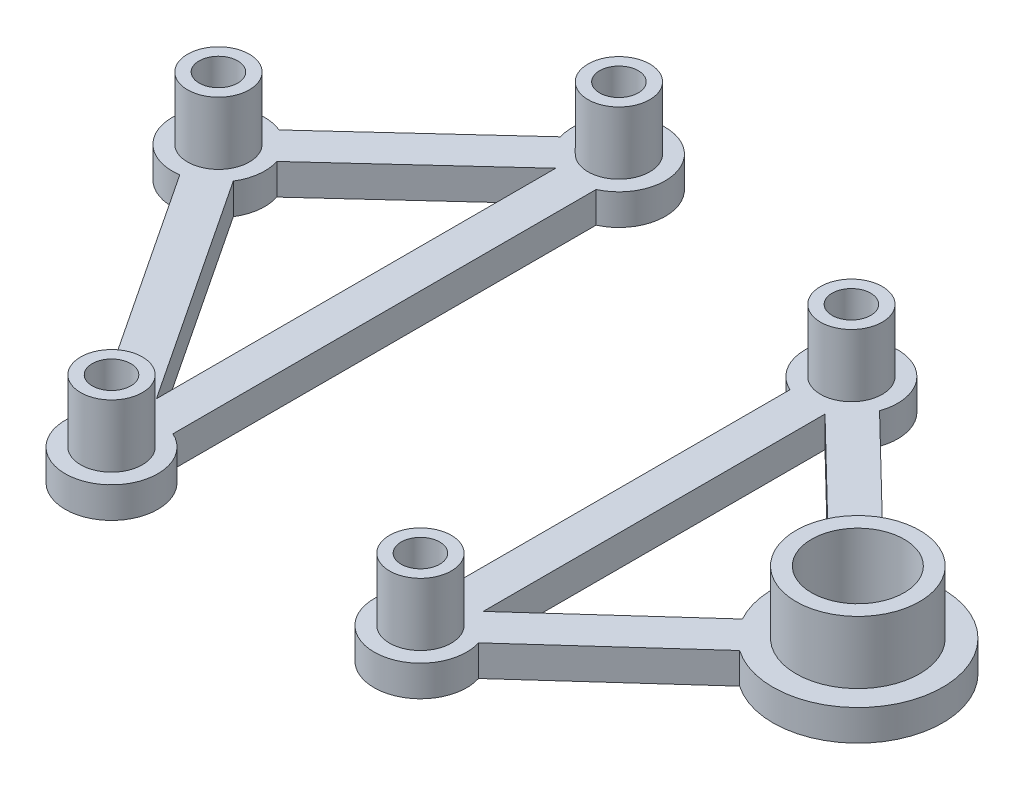
from build123d import *

# Parameters (mm, degrees)
EXTRUDE_1_DEPTH     = 4
EXTRUDE_1_2_DEPTH   = 4
SKETCH_3_R          = 4
SKETCH_3_R_2        = 2.5
EXTRUDE_2_DEPTH     = 8.1
SKETCH_5_R          = 4
SKETCH_5_R_2        = 2.5
SKETCH_5_R_3        = 8
EXTRUDE_3_DEPTH     = 8.1
SKETCH_6_R          = 6
CUT_EXTRUDE_1_DEPTH = 104.054679137


with BuildPart() as part:
    # Эскиз1 → Бобышка-Вытянуть1 (new body)
    with BuildSketch(Plane(origin=(0, 0, 0), x_dir=(1, 0, 0), z_dir=(0, 1, 0))):
        with BuildLine():
            Line((-64.701657296, 46.403150718), (-45.708049543, 63.851170528))
            ThreePointArc((-45.708049543, 63.851170528), (-37.586941576, 71.193373193), (-37.5, 60.245643943))
            Line((-37.5, 60.245643943), (-37.5, 5.454356057))
            ThreePointArc((-37.5, 5.454356057), (-38.272069955, -5.745803491), (-45.093798955, 3.170680085))
            Line((-45.093798955, 3.170680085), (-66.103993638, 34.943592009))
            ThreePointArc((-66.103993638, 34.943592009), (-72.98273861, 41.600945273), (-64.701657296, 46.403150718))
        make_face()
        with BuildLine():
            Line((-61.319115896, 42.72097559), (-42.5, 60.008702662))
            Line((-42.5, 60.008702662), (-42.5, 8.313130943))
            Line((-42.5, 8.313130943), (-61.933366483, 37.701466034))
            ThreePointArc((-61.933366483, 37.701466034), (-61.071592268, 40.143346965), (-61.319115896, 42.72097559))
        make_face(mode=Mode.SUBTRACT)
    extrude(amount=EXTRUDE_1_DEPTH)

    # Эскиз3 → Бобышка-Вытянуть2 (add)
    # profile 1 of 3: a face of its own
    with BuildSketch(Plane(origin=(0, 4, 0), x_dir=(1, 0, 0), z_dir=(0, 1, 0))):
        with Locations(Location((-67.027165439, 40.872146119, 0), (0, 0, 90))):
            Circle(SKETCH_3_R)
        with Locations(Location((-67.027165439, 40.872146119, 0), (0, 0, 270))):
            Circle(SKETCH_3_R_2, mode=Mode.SUBTRACT)
    # profile 2 of 3: a face of its own
    with BuildSketch(Plane(origin=(0, 4, 0), x_dir=(1, 0, 0), z_dir=(0, 1, 0))):
        with Locations(Location((-40, 65.7, 0), (0, 0, 90))):
            Circle(SKETCH_3_R)
        with Locations(Location((-40, 65.7, 0), (0, 0, 270))):
            Circle(SKETCH_3_R_2, mode=Mode.SUBTRACT)
    # profile 3 of 3: a face of its own
    with BuildSketch(Plane(origin=(0, 4, 0), x_dir=(1, 0, 0), z_dir=(0, 1, 0))):
        with Locations(Location((-40, 0, 0), (0, 0, 90))):
            Circle(SKETCH_3_R)
        with Locations(Location((-40, 0, 0), (0, 0, 270))):
            Circle(SKETCH_3_R_2, mode=Mode.SUBTRACT)
    extrude(amount=EXTRUDE_2_DEPTH)


with BuildPart() as body_2:
    # Эскиз1 → Extrude 1 2 (new body)
    with BuildSketch(Plane(origin=(0, 0, 0), x_dir=(1, 0, 0), z_dir=(0, 1, 0))):
        with BuildLine():
            Line((-2.5, 50.345643943), (-2.5, 5.454356057))
            ThreePointArc((-2.5, 5.454356057), (-2.436350888, -5.483082559), (5.723536854, 1.800312716))
            Line((5.723536854, 1.800312716), (23.485802209, 17.841335562))
            ThreePointArc((23.485802209, 17.841335562), (40.75840018, 26.67494221), (23.820802166, 36.135017294))
            Line((23.820802166, 36.135017294), (5.653785721, 53.791341986))
            ThreePointArc((5.653785721, 53.791341986), (-2.335551293, 61.326771223), (-2.5, 50.345643943))
        make_face()
        with BuildLine():
            Line((20.134637111, 21.55208919), (2.5, 5.626326843))
            Line((2.5, 5.626326843), (2.5, 49.884082804))
            Line((2.5, 49.884082804), (20.336024345, 32.549445717))
            ThreePointArc((20.336024345, 32.549445717), (18.762088009, 27.077745962), (20.134637111, 21.55208919))
        make_face(mode=Mode.SUBTRACT)
    extrude(amount=EXTRUDE_1_2_DEPTH)

    # Эскиз5 → Бобышка-Вытянуть3 (add)
    # profile 1 of 3: a face of its own
    with BuildSketch(Plane(origin=(0, 4, 0), x_dir=(1, 0, 0), z_dir=(0, 1, 0))):
        with Locations(Location((0, 55.8, 0), (0, 0, 270))):
            Circle(SKETCH_5_R)
        with Locations(Location((0, 55.8, 0), (0, 0, 270))):
            Circle(SKETCH_5_R_2, mode=Mode.SUBTRACT)
    # profile 2 of 3: a face of its own
    with BuildSketch(Plane(origin=(0, 4, 0), x_dir=(1, 0, 0), z_dir=(0, 1, 0))):
        with Locations(Location((0, 0, 0), (0, 0, 270))):
            Circle(SKETCH_5_R)
        with Locations(Location((0, 0, 0), (0, 0, 270))):
            Circle(SKETCH_5_R_2, mode=Mode.SUBTRACT)
    # profile 3 of 3: a face of its own
    with BuildSketch(Plane(origin=(0, 4, 0), x_dir=(1, 0, 0), z_dir=(0, 1, 0))):
        with Locations(Location((29.760244095, 26.876344086, 0), (0, 0, 270))):
            Circle(SKETCH_5_R_3)
    extrude(amount=EXTRUDE_3_DEPTH)

    # Эскиз6 → Вырез-Вытянуть1 (cut, through all)
    with BuildSketch(Plane(origin=(0, 12.1, 0), x_dir=(1, 0, 0), z_dir=(0, 1, 0))):
        with Locations(Location((29.760244095, 26.876344086, 0), (0, 0, 270))):
            Circle(SKETCH_6_R)
    extrude(amount=-CUT_EXTRUDE_1_DEPTH, mode=Mode.SUBTRACT)


solid = Compound([part.part, body_2.part])
